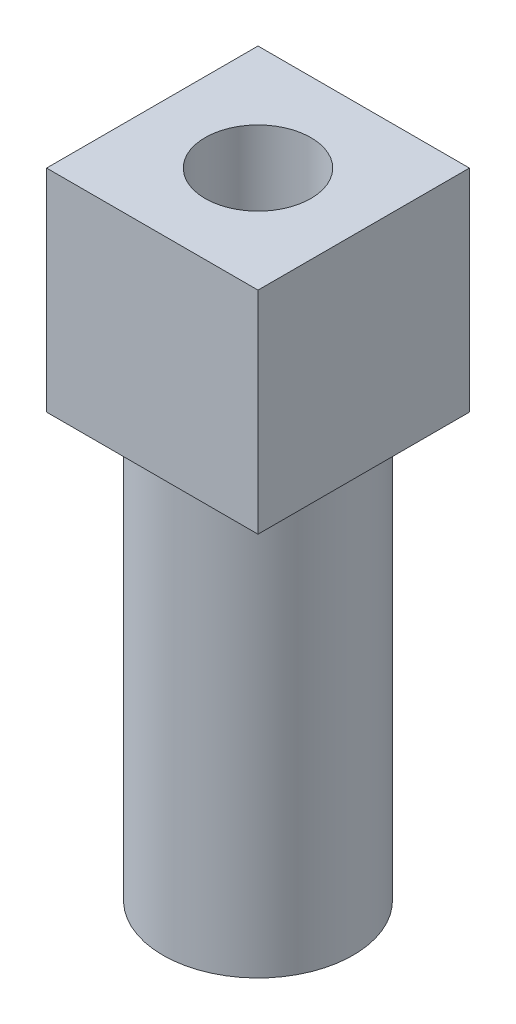
from build123d import *

# Parameters (mm, degrees)
SKIZZE1_W                       = 4.5
SKIZZE1_H                       = 20
SKIZZE5_W                       = 10
SKIZZE5_H                       = 10
AUFSATZ_LINEAR_AUSTRAGEN1_DEPTH = 10
SKETCH1_R                       = 2.5
CUT_EXTRUDE1_DEPTH              = 31.822070015


with BuildPart() as part:
    # Skizze1 → Rotation1 (revolve)
    with BuildSketch(Plane.XY, mode=Mode.PRIVATE) as rotation1_sk:
        with Locations((2.25, 10)):
            Rectangle(SKIZZE1_W, SKIZZE1_H)
    revolve(rotation1_sk.sketch.rotate(Axis((0, -2.459302686, 0), (0, 1, 0)), 90), axis=Axis((0, -2.459302686, 0), (0, 1, 0)))

    # Skizze5 → Aufsatz-Linear austragen1 (add)
    with BuildSketch(Plane(origin=(0, 20, 0), x_dir=(1, 0, 0), z_dir=(0, 1, 0))):
        Rectangle(SKIZZE5_W, SKIZZE5_H)
    extrude(amount=AUFSATZ_LINEAR_AUSTRAGEN1_DEPTH)

    # Sketch1 → Cut-Extrude1 (cut, through all)
    with BuildSketch(Plane(origin=(0, 30, 0), x_dir=(1, 0, 0), z_dir=(0, 1, 0))):
        with Locations(Location((0, 0, 0), (0, 0, 270))):
            Circle(SKETCH1_R)
    extrude(amount=-CUT_EXTRUDE1_DEPTH, mode=Mode.SUBTRACT)


solid = part.part
